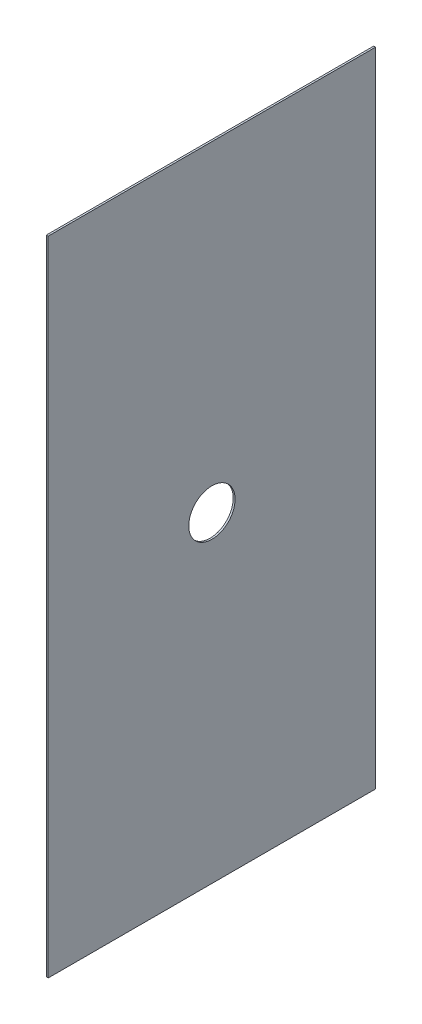
from build123d import *

# Parameters (mm, degrees)
CROQUIS1_W     = 1040
CROQUIS1_H     = 530
EXTRUIR1_DEPTH = 3
CROQUIS2_R     = 37.5
EXTRUIR2_DEPTH = 584.638586798


with BuildPart() as part:
    # Croquis1 → Extruir1 (new body)
    with BuildSketch(Plane(origin=(0, 0, 0), x_dir=(0, -1, 0), z_dir=(1, 0, 0))):
        Rectangle(CROQUIS1_W, CROQUIS1_H)
    extrude(amount=EXTRUIR1_DEPTH)

    # Croquis2 → Extruir2 (cut, through all)
    with BuildSketch(Plane(origin=(3, 0, 0), x_dir=(0, 0, -1), z_dir=(1, 0, 0))):
        Circle(CROQUIS2_R)
    extrude(amount=-EXTRUIR2_DEPTH, mode=Mode.SUBTRACT)


solid = part.part
